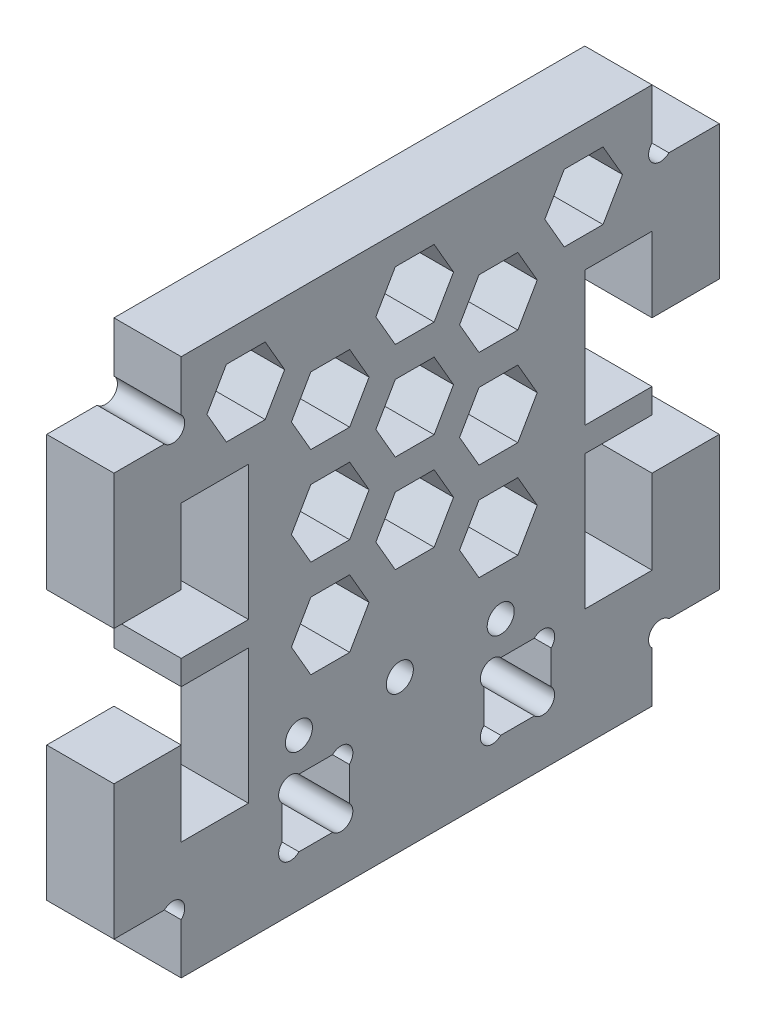
from build123d import *

# Parameters (mm, degrees)
SKETCH3_W                 = 88.9
SKETCH3_H                 = 101.6
SQUARE_EXTRUSION_DEPTH    = 12.7
SKETCH4_R                 = 2.24536
SKETCH4_W                 = 12.7
SKETCH4_H                 = 12.7
SLOTTING_HOLES_DEPTH      = 12.7
HONEYCOMB_POCKETING_DEPTH = 12.7
SKETCH10_W                = 12.7
SKETCH10_H                = 12.7
SIDE_SLOTS_DEPTH          = 12.7
SKETCH12_R                = 2.5527
SKETCH12_R_2              = 2.24536
CUT_EXTRUDE1_DEPTH        = 78.51162816
SKETCH14_W                = 12.7
SKETCH14_H                = 25.4
CUT_EXTRUDE4_DEPTH        = 78.51162816


with BuildPart() as part:
    # Sketch3 → Square Extrusion (new body)
    with BuildSketch(Plane(origin=(0, 0, 0), x_dir=(0, 0, -1), z_dir=(1, 0, 0))):
        Rectangle(SKETCH3_W, SKETCH3_H)
    extrude(amount=SQUARE_EXTRUSION_DEPTH)

    # Sketch4 → Slotting Holes (cut)
    with BuildSketch(Plane(origin=(12.7, 0, 0), x_dir=(0, 0, -1), z_dir=(1, 0, 0))):
        with BuildLine():
            ThreePointArc((-22.224581463, -28.575), (-25.400209282, -28.574790718), (-25.4, -31.750418537))
            Line((-25.4, -31.750418537), (-25.4, -28.575))
            Line((-25.4, -28.575), (-22.224581463, -28.575))
        make_face()
        with BuildLine():
            Line((-25.4, -28.575), (-25.4, -31.750418537))
            ThreePointArc((-25.4, -31.750418537), (-22.953101219, -32.236885515), (-21.56714, -30.1625))
            ThreePointArc((-21.56714, -30.1625), (-21.73800123, -29.303374641), (-22.224581463, -28.575))
            Line((-22.224581463, -28.575), (-25.4, -28.575))
        make_face()
        with Locations((-23.8125, -39.6875)):
            Circle(SKETCH4_R)
        with Locations((-14.2875, -39.6875)):
            Circle(SKETCH4_R)
        with Locations((-14.2875, -30.1625)):
            Circle(SKETCH4_R)
        with Locations((-23.8125, -30.1625)):
            Circle(SKETCH4_R)
        with Locations((-19.05, -34.925)):
            Rectangle(SKETCH4_W, SKETCH4_H)
        with BuildLine():
            ThreePointArc((-15.875418537, -28.575), (-15.875209282, -31.750209282), (-12.7, -31.750418537))
            Line((-12.7, -31.750418537), (-12.7, -28.575))
            Line((-12.7, -28.575), (-15.875418537, -28.575))
        make_face()
        with BuildLine():
            Line((-12.7, -28.575), (-12.7, -31.750418537))
            ThreePointArc((-12.7, -31.750418537), (-12.213114485, -31.021898781), (-12.04214, -30.1625))
            ThreePointArc((-12.04214, -30.1625), (-13.428374641, -28.08800123), (-15.875418537, -28.575))
            Line((-15.875418537, -28.575), (-12.7, -28.575))
        make_face()
        with BuildLine():
            Line((-25.4, -38.099581463), (-25.4, -41.275))
            Line((-25.4, -41.275), (-22.224581463, -41.275))
            ThreePointArc((-22.224581463, -41.275), (-21.73800123, -40.546625359), (-21.56714, -39.6875))
            ThreePointArc((-21.56714, -39.6875), (-22.953101219, -37.613114485), (-25.4, -38.099581463))
        make_face()
        with BuildLine():
            Line((-22.224581463, -41.275), (-25.4, -41.275))
            Line((-25.4, -41.275), (-25.4, -38.099581463))
            ThreePointArc((-25.4, -38.099581463), (-25.400209282, -41.275209282), (-22.224581463, -41.275))
        make_face()
        with BuildLine():
            ThreePointArc((-12.7, -38.099581463), (-15.875209282, -38.099790718), (-15.875418537, -41.275))
            Line((-15.875418537, -41.275), (-12.7, -41.275))
            Line((-12.7, -41.275), (-12.7, -38.099581463))
        make_face()
        with BuildLine():
            Line((-12.7, -41.275), (-15.875418537, -41.275))
            ThreePointArc((-15.875418537, -41.275), (-13.428374641, -41.76199877), (-12.04214, -39.6875))
            ThreePointArc((-12.04214, -39.6875), (-12.213114485, -38.828101219), (-12.7, -38.099581463))
            Line((-12.7, -38.099581463), (-12.7, -41.275))
        make_face()
        with BuildLine():
            ThreePointArc((16.53286, -30.1625), (16.36199877, -29.303374641), (15.875418537, -28.575))
            Line((15.875418537, -28.575), (12.7, -28.575))
            Line((12.7, -28.575), (12.7, -31.750418537))
            ThreePointArc((12.7, -31.750418537), (15.146898781, -32.236885515), (16.53286, -30.1625))
        make_face()
        with BuildLine():
            Line((12.7, -28.575), (15.875418537, -28.575))
            ThreePointArc((15.875418537, -28.575), (12.699790718, -28.574790718), (12.7, -31.750418537))
            Line((12.7, -31.750418537), (12.7, -28.575))
        make_face()
        with Locations((23.8125, -30.1625)):
            Circle(SKETCH4_R)
        with Locations((14.2875, -30.1625)):
            Circle(SKETCH4_R)
        with Locations((14.2875, -39.6875)):
            Circle(SKETCH4_R)
        with Locations((23.8125, -39.6875)):
            Circle(SKETCH4_R)
        with Locations((19.05, -34.925)):
            Rectangle(SKETCH4_W, SKETCH4_H)
        with BuildLine():
            Line((25.4, -31.750418537), (25.4, -28.575))
            Line((25.4, -28.575), (22.224581463, -28.575))
            ThreePointArc((22.224581463, -28.575), (22.224790718, -31.750209282), (25.4, -31.750418537))
        make_face()
        with BuildLine():
            Line((22.224581463, -28.575), (25.4, -28.575))
            Line((25.4, -28.575), (25.4, -31.750418537))
            ThreePointArc((25.4, -31.750418537), (25.886885515, -31.021898781), (26.05786, -30.1625))
            ThreePointArc((26.05786, -30.1625), (24.671625359, -28.08800123), (22.224581463, -28.575))
        make_face()
        with BuildLine():
            ThreePointArc((26.05786, -39.6875), (25.886885515, -38.828101219), (25.4, -38.099581463))
            Line((25.4, -38.099581463), (25.4, -41.275))
            Line((25.4, -41.275), (22.224581463, -41.275))
            ThreePointArc((22.224581463, -41.275), (24.671625359, -41.76199877), (26.05786, -39.6875))
        make_face()
        with BuildLine():
            Line((25.4, -41.275), (25.4, -38.099581463))
            ThreePointArc((25.4, -38.099581463), (22.224790718, -38.099790718), (22.224581463, -41.275))
            Line((22.224581463, -41.275), (25.4, -41.275))
        make_face()
        with BuildLine():
            ThreePointArc((16.53286, -39.6875), (15.146898781, -37.613114485), (12.7, -38.099581463))
            Line((12.7, -38.099581463), (12.7, -41.275))
            Line((12.7, -41.275), (15.875418537, -41.275))
            ThreePointArc((15.875418537, -41.275), (16.36199877, -40.546625359), (16.53286, -39.6875))
        make_face()
        with BuildLine():
            Line((12.7, -41.275), (12.7, -38.099581463))
            ThreePointArc((12.7, -38.099581463), (12.699790718, -41.275209282), (15.875418537, -41.275))
            Line((15.875418537, -41.275), (12.7, -41.275))
        make_face()
    extrude(amount=-SLOTTING_HOLES_DEPTH, mode=Mode.SUBTRACT)

    # Sketch9 → Honeycomb Pocketing (cut)
    with BuildSketch(Plane(origin=(12.7, 0, 0), x_dir=(0, 0, -1), z_dir=(1, 0, 0))):
        Polygon((-35.926583558, 32.58118298), (-28.594235139, 32.581185003), (-24.928062682, 38.931186014), (-28.594238643, 45.281185003), (-35.926587062, 45.28118298), (-39.592759519, 38.931181968), align=None)
        Polygon((-4.030867936, 32.58118298), (3.301480483, 32.581185003), (6.96765294, 38.931186014), (3.301476978, 45.281185003), (-4.03087144, 45.28118298), (-7.697043898, 38.931181968), align=None)
        Polygon((27.864847685, 32.58118298), (35.197196104, 32.581185003), (38.863368561, 38.931186014), (35.1971926, 45.281185003), (27.864844181, 45.28118298), (24.198671724, 38.931181968), align=None)
        Polygon((-19.978725747, 23.37368298), (-12.646377328, 23.373685003), (-8.980204871, 29.723686014), (-12.646380832, 36.073685003), (-19.978729251, 36.07368298), (-23.644901708, 29.723681968), align=None)
        Polygon((11.771274253, 23.37368298), (19.103622672, 23.373685003), (22.769795129, 29.723686014), (19.103619168, 36.073685003), (11.771270749, 36.07368298), (8.105098292, 29.723681968), align=None)
        Polygon((-4.030867936, 14.16618298), (3.301480483, 14.166185003), (6.96765294, 20.516186014), (3.301476978, 26.866185003), (-4.03087144, 26.86618298), (-7.697043898, 20.516181968), align=None)
        Polygon((-19.978725747, 4.95868298), (-12.646377328, 4.958685003), (-8.980204871, 11.308686014), (-12.646380832, 17.658685003), (-19.978729251, 17.65868298), (-23.644901708, 11.308681968), align=None)
        Polygon((11.771274253, 4.95868298), (19.103622672, 4.958685003), (22.769795129, 11.308686014), (19.103619168, 17.658685003), (11.771270749, 17.65868298), (8.105098292, 11.308681968), align=None)
        Polygon((-4.030867936, -4.24881702), (3.301480483, -4.248814997), (6.96765294, 2.101186014), (3.301476978, 8.451185003), (-4.03087144, 8.45118298), (-7.697043898, 2.101181968), align=None)
        Polygon((-19.978725747, -13.45631702), (-12.646377328, -13.456314997), (-8.980204871, -7.106313986), (-12.646380832, -0.756314997), (-19.978729251, -0.75631702), (-23.644901708, -7.106318032), align=None)
        Polygon((11.771274253, -13.45631702), (19.103622672, -13.456314997), (22.769795129, -7.106313986), (19.103619168, -0.756314997), (11.771270749, -0.75631702), (8.105098292, -7.106318032), align=None)
    extrude(amount=-HONEYCOMB_POCKETING_DEPTH, mode=Mode.SUBTRACT)

    # Sketch10 → Side Slots (add)
    with BuildSketch(Plane(origin=(12.7, 0, 0), x_dir=(0, 0, -1), z_dir=(1, 0, 0))):
        with Locations((-50.8, 31.75)):
            Rectangle(SKETCH10_W, SKETCH10_H)
        with Locations((-50.8, 19.05)):
            Rectangle(SKETCH10_W, SKETCH10_H)
        with Locations((-50.8, -19.05)):
            Rectangle(SKETCH10_W, SKETCH10_H)
        with Locations((-50.8, -31.75)):
            Rectangle(SKETCH10_W, SKETCH10_H)
        with Locations((50.8, -19.05)):
            Rectangle(SKETCH10_W, SKETCH10_H)
        with Locations((50.8, -31.75)):
            Rectangle(SKETCH10_W, SKETCH10_H)
        with Locations((50.8, 19.05)):
            Rectangle(SKETCH10_W, SKETCH10_H)
        with Locations((50.8, 31.75)):
            Rectangle(SKETCH10_W, SKETCH10_H)
    extrude(amount=-SIDE_SLOTS_DEPTH)

    # Sketch12 → Cut-Extrude1 (cut, through all)
    with BuildSketch(Plane(origin=(12.7, 0, 0), x_dir=(0, 0, -1), z_dir=(1, 0, 0))):
        with Locations((-22.225, -22.225)):
            Circle(SKETCH12_R)
        with Locations((-3.175, -22.225)):
            Circle(SKETCH12_R)
        with Locations((15.875, -22.225)):
            Circle(SKETCH12_R)
        with Locations((-46.0375, 39.6875)):
            Circle(SKETCH12_R_2)
        with Locations((46.0375, 39.6875)):
            Circle(SKETCH12_R_2)
        with Locations((46.0375, -39.6875)):
            Circle(SKETCH12_R_2)
        with Locations((-46.0375, -39.6875)):
            Circle(SKETCH12_R_2)
    extrude(amount=-CUT_EXTRUDE1_DEPTH, mode=Mode.SUBTRACT)

    # Sketch14 → Cut-Extrude4 (cut, through all)
    with BuildSketch(Plane(origin=(12.7, 0, 0), x_dir=(0, 0, -1), z_dir=(1, 0, 0))):
        with Locations((-38.1, -15.875)):
            Rectangle(SKETCH14_W, SKETCH14_H)
        with Locations((-38.1, 14.16618)):
            Rectangle(SKETCH14_W, SKETCH14_H)
        with Locations((38.1, -15.875)):
            Rectangle(SKETCH14_W, SKETCH14_H)
        with Locations((38.1, 14.16618)):
            Rectangle(SKETCH14_W, SKETCH14_H)
    extrude(amount=-CUT_EXTRUDE4_DEPTH, mode=Mode.SUBTRACT)


solid = part.part
